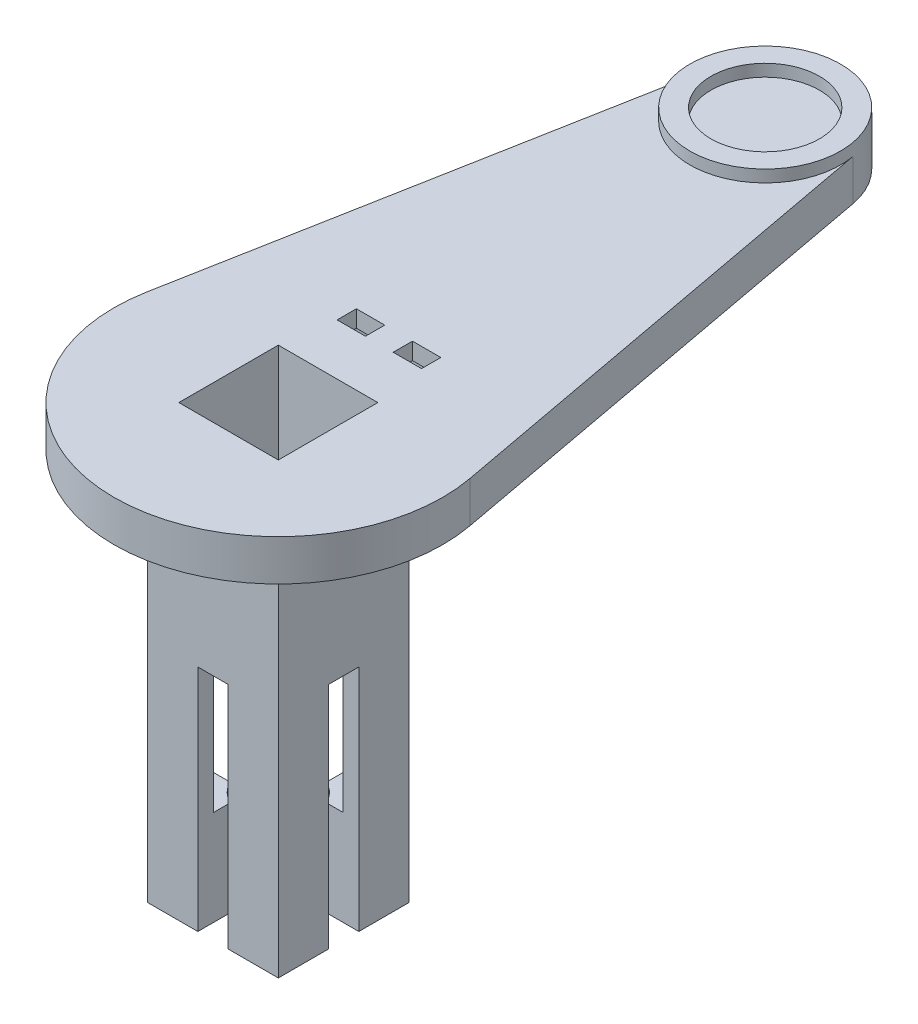
from build123d import *

# Parameters (mm, degrees)
BOSS_EXTRUDE1_DEPTH = 6.8
SKETCH2_R           = 12.5
SKETCH2_R_2         = 9
BOSS_EXTRUDE2_DEPTH = 2
SKETCH3_W           = 4.7
SKETCH3_H           = 3.2
CUT_EXTRUDE1_DEPTH  = 10
SKETCH7_R           = 21.25
CUT_EXTRUDE4_DEPTH  = 4
SKETCH8_W           = 21.7
SKETCH8_H           = 21.7
BOSS_EXTRUDE3_DEPTH = 69
SKETCH9_W           = 16.5
SKETCH9_H           = 16.5
CUT_EXTRUDE5_DEPTH  = 56
SKETCH10_R          = 6
CUT_EXTRUDE6_DEPTH  = 99
CUT_EXTRUDE7_DEPTH  = 38


with BuildPart() as part:
    # Sketch1 → Boss-Extrude1 (new body)
    with BuildSketch(Plane(origin=(0, 0, 0), x_dir=(1, 0, 0), z_dir=(0, 1, 0))):
        with BuildLine():
            Line((-12.289695868, 83.033281734), (-26.791536992, 4.97755418))
            ThreePointArc((-26.791536992, 4.97755418), (0, -27.25), (26.791536992, 4.97755418))
            Line((26.791536992, 4.97755418), (12.289695868, 83.033281734))
            ThreePointArc((12.289695868, 83.033281734), (0, 93.25), (-12.289695868, 83.033281734))
        make_face()
    extrude(amount=BOSS_EXTRUDE1_DEPTH)

    # Sketch2 → Boss-Extrude2 (add)
    with BuildSketch(Plane(origin=(0, 6.8, 0), x_dir=(1, 0, 0), z_dir=(0, 1, 0))):
        with Locations(Location((0, 80.75, 0), (0, 0, 169.47511628))):
            Circle(SKETCH2_R)
        with Locations(Location((0, 80.75, 0), (0, 0, 270))):
            Circle(SKETCH2_R_2, mode=Mode.SUBTRACT)
    extrude(amount=BOSS_EXTRUDE2_DEPTH)

    # Sketch3 → Cut-Extrude1 (cut)
    with BuildSketch(Plane(origin=(0, 6.8, 0), x_dir=(1, 0, 0), z_dir=(0, 1, 0))):
        with Locations((4.65, 18.35)):
            Rectangle(SKETCH3_W, SKETCH3_H)
        with Locations((-4.65, 18.35)):
            Rectangle(SKETCH3_W, SKETCH3_H)
    extrude(amount=-CUT_EXTRUDE1_DEPTH, mode=Mode.SUBTRACT)

    # Sketch7 → Cut-Extrude4 (cut)
    with BuildSketch(Plane.XZ):
        with Locations(Location((0, 0, 0), (0, 0, 270))):
            Circle(SKETCH7_R)
    extrude(amount=-CUT_EXTRUDE4_DEPTH, mode=Mode.SUBTRACT)

    # Sketch8 → Boss-Extrude3 (add)
    with BuildSketch(Plane.XZ.offset(-4)):
        Rectangle(SKETCH8_W, SKETCH8_H)
    extrude(amount=BOSS_EXTRUDE3_DEPTH)

    # Sketch9 → Cut-Extrude5 (cut)
    with BuildSketch(Plane(origin=(0, 6.8, 0), x_dir=(1, 0, 0), z_dir=(0, 1, 0))):
        Rectangle(SKETCH9_W, SKETCH9_H)
    extrude(amount=-CUT_EXTRUDE5_DEPTH, mode=Mode.SUBTRACT)

    # Sketch10 → Cut-Extrude6 (cut)
    with BuildSketch(Plane.XZ.offset(65)):
        with Locations(Location((0, 0, 0), (0, 0, 270))):
            Circle(SKETCH10_R)
    extrude(amount=-CUT_EXTRUDE6_DEPTH, mode=Mode.SUBTRACT)

    # Sketch11 → Cut-Extrude7 (cut)
    with BuildSketch(Plane.XZ.offset(65)):
        with BuildLine():
            Line((-6, 2.5), (-5.454356057, 2.5))
            ThreePointArc((-5.454356057, 2.5), (-6, 0), (-5.454356057, -2.5))
            Line((-5.454356057, -2.5), (-6, -2.5))
            Line((-6, -2.5), (-10.85, -2.5))
            Line((-10.85, -2.5), (-10.85, 2.5))
            Line((-10.85, 2.5), (-6, 2.5))
        make_face()
        with BuildLine():
            Line((-2.5, 6), (-2.5, 5.454356057))
            ThreePointArc((-2.5, 5.454356057), (0, 6), (2.5, 5.454356057))
            Line((2.5, 5.454356057), (2.5, 6))
            Line((2.5, 6), (2.5, 10.85))
            Line((2.5, 10.85), (-2.5, 10.85))
            Line((-2.5, 10.85), (-2.5, 6))
        make_face()
        with BuildLine():
            Line((-2.5, -6), (-2.5, -10.85))
            Line((-2.5, -10.85), (2.5, -10.85))
            Line((2.5, -10.85), (2.5, -6))
            Line((2.5, -6), (2.5, -5.454356057))
            ThreePointArc((2.5, -5.454356057), (0, -6), (-2.5, -5.454356057))
            Line((-2.5, -5.454356057), (-2.5, -6))
        make_face()
        with BuildLine():
            Line((6, -2.5), (10.85, -2.5))
            Line((10.85, -2.5), (10.85, 2.5))
            Line((10.85, 2.5), (6, 2.5))
            Line((6, 2.5), (5.454356057, 2.5))
            ThreePointArc((5.454356057, 2.5), (6, 0), (5.454356057, -2.5))
            Line((5.454356057, -2.5), (6, -2.5))
        make_face()
    extrude(amount=-CUT_EXTRUDE7_DEPTH, mode=Mode.SUBTRACT)


solid = part.part
